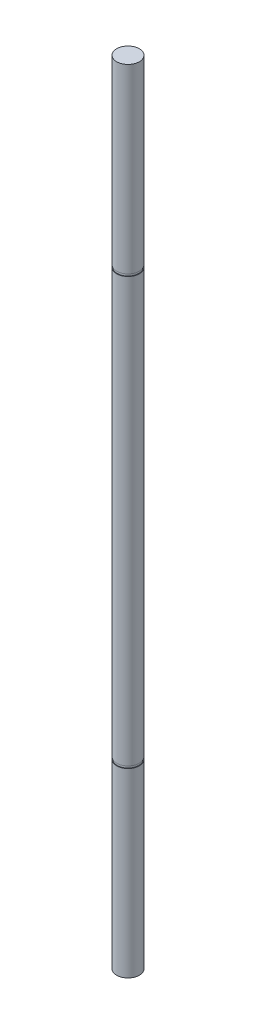
from build123d import *

# Parameters (mm, degrees)
SKETCH_1_R      = 4
EXTRUDE_1_DEPTH = 140
SKETCH_3_W      = 5
SKETCH_3_H      = 0.8


with BuildPart() as part:
    # 草图1 → 凸台-拉伸1 (new, symmetric)
    with BuildSketch(Plane(origin=(0, 0, 0), x_dir=(1, 0, 0), z_dir=(0, 1, 0))):
        with Locations(Location((0, 0, 0), (0, 0, 270))):
            Circle(SKETCH_1_R)
    extrude(amount=EXTRUDE_1_DEPTH, both=True)

    # 草图3 → 切除-旋转1 (revolve, cut)
    with BuildSketch(Plane(origin=(0, 0, 0), x_dir=(0, 0, -1), z_dir=(1, 0, 0)), mode=Mode.PRIVATE) as cut_revolve_1_sk:
        with Locations((6.3, 75.4)):
            Rectangle(SKETCH_3_W, SKETCH_3_H)
    cut_revolve_1 = revolve(cut_revolve_1_sk.sketch.rotate(Axis((0, 140, 0), (0, -1, 0)), 180), axis=Axis((0, 140, 0), (0, -1, 0)), mode=Mode.SUBTRACT)

    # 镜向1: 切除-旋转1 across plane
    add(cut_revolve_1.mirror(Plane.ZX), mode=Mode.SUBTRACT)


solid = part.part
